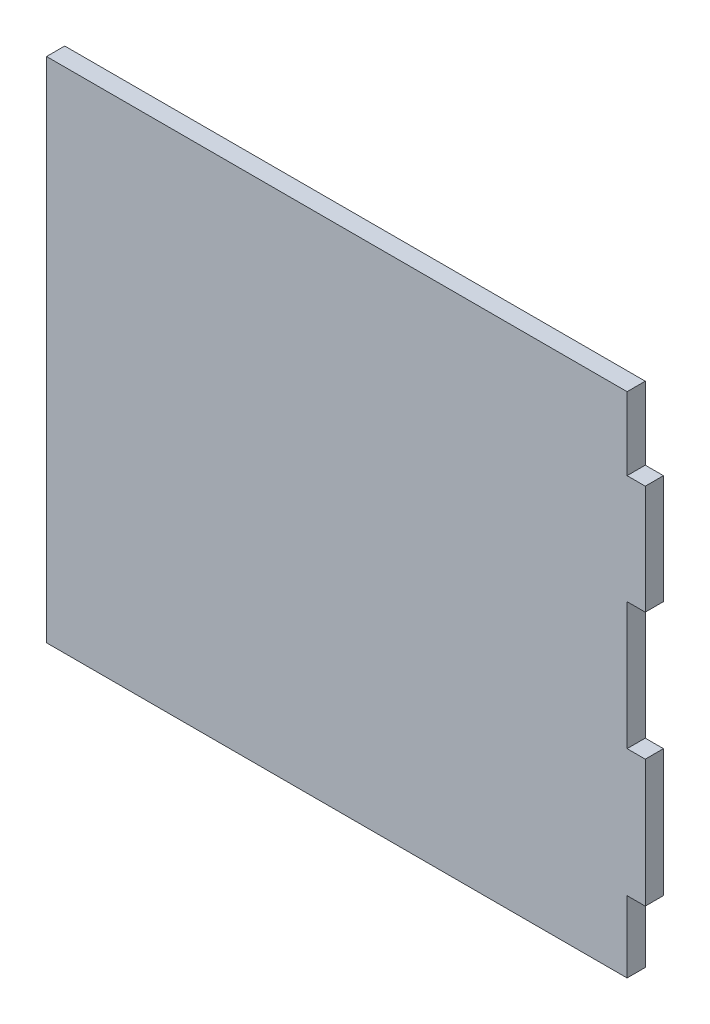
from build123d import *

# Parameters (mm, degrees)
BOSS_EXTRUDE1_DEPTH = 6.35


with BuildPart() as part:
    # Model → Boss-Extrude1 (new body)
    with BuildSketch(Plane.XY):
        Polygon((-104.5285, 88.6534), (98.1784, 88.6534), (98.1784, 63.2534), (104.5284, 63.2534), (104.5284, 25.1534), (98.1784, 25.1534), (98.1784, -19.2966), (104.5284, -19.2966), (104.5284, -63.7465), (98.1784, -63.7465), (98.1784, -88.6533), (-104.5285, -88.6533), align=None)
    extrude(amount=BOSS_EXTRUDE1_DEPTH)


solid = part.part
